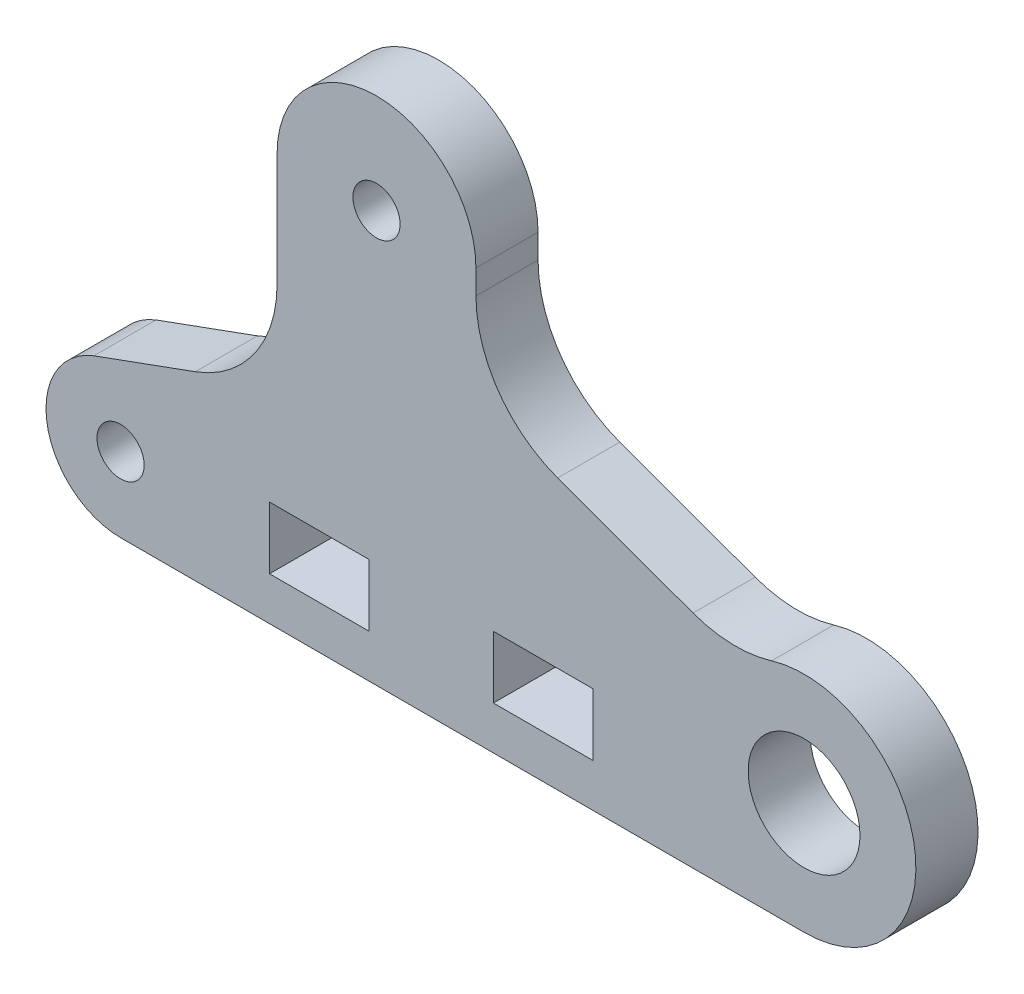
from build123d import *

# Parameters (mm, degrees)
ESQUISSE1_R        = 1.9
ESQUISSE1_R_2      = 4.5
ESQUISSE1_W        = 8
ESQUISSE1_H        = 5
BOSS_EXTRU_1_DEPTH = 5


with BuildPart() as part:
    # Esquisse1 → Boss.-Extru.1 (new body)
    with BuildSketch(Plane.XY):
        with BuildLine():
            Line((-22.984184861, -5.970148314), (-31.145801552, -8.941620925))
            ThreePointArc((-31.145801552, -8.941620925), (-34.899958966, -15.635885981), (-29, -20.544792857))
            Line((-29, -20.544792857), (26, -20.544792857))
            ThreePointArc((26, -20.544792857), (34.902651948, -10.224645785), (23.388264466, -2.932079143))
            ThreePointArc((23.388264466, -2.932079143), (20.213182454, -3.358665896), (17.066134535, -2.7593234))
            Line((17.066134535, -2.7593234), (6.175413191, 1.204575468))
            ThreePointArc((6.175413191, 1.204575468), (1.404093414, 4.865736977), (-0.404386386, 10.601501853))
            Line((-0.404386386, 10.601501853), (-0.404386386, 12.54541747))
            ThreePointArc((-0.404386386, 12.54541747), (-8.404386386, 20.54541747), (-16.404387146, 12.54541747))
            Line((-16.404387146, 12.54541747), (-16.404387146, 3.426777584))
            ThreePointArc((-16.404387146, 3.426777584), (-18.212866443, -2.308986408), (-22.984184861, -5.970148314))
        make_face()
        with Locations((-8.404386386, 12.54541747)):
            Circle(ESQUISSE1_R, mode=Mode.SUBTRACT)
        with Locations((-29, -14.544792857)):
            Circle(ESQUISSE1_R, mode=Mode.SUBTRACT)
        with Locations((26, -11.544792857)):
            Circle(ESQUISSE1_R_2, mode=Mode.SUBTRACT)
        with Locations((4.999995852, -14.564792857)):
            Rectangle(ESQUISSE1_W, ESQUISSE1_H, mode=Mode.SUBTRACT)
        Polygon((-17.000004148, -12.064792857), (-17.013857883, -17.064792857), (-9.000004148, -17.064792857), (-9.000004148, -12.064792857), align=None, mode=Mode.SUBTRACT)
    extrude(amount=BOSS_EXTRU_1_DEPTH)


solid = part.part
